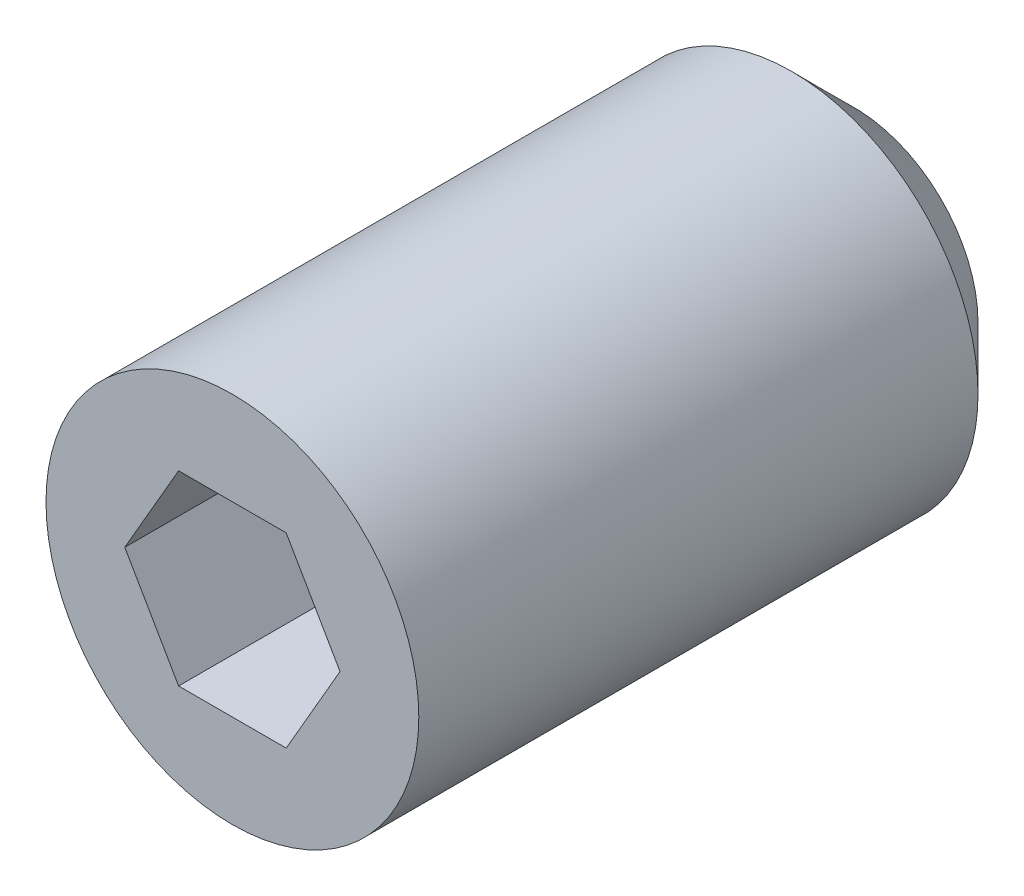
from build123d import *

# Parameters (mm, degrees)
SKETCH1_R           = 1.5
BOSS_EXTRUDE1_DEPTH = 5
CUT_EXTRUDE1_DEPTH  = 1.2


with BuildPart() as part:
    # Sketch1 → Boss-Extrude1 (new body)
    with BuildSketch(Plane.XY):
        Circle(SKETCH1_R)
    extrude(amount=-BOSS_EXTRUDE1_DEPTH)

    # Sketch2 → Cut-Extrude1 (cut)
    with BuildSketch(Plane.XY):
        Polygon((0.866025404, 0), (0.433012702, 0.75), (-0.433012702, 0.75), (-0.866025404, 0), (-0.433012702, -0.75), (0.433012702, -0.75), align=None)
    extrude(amount=-CUT_EXTRUDE1_DEPTH, mode=Mode.SUBTRACT)

    # Sketch3 → Chamfer 2 (revolve, cut)
    with BuildSketch(Plane(origin=(0, 0, 0), x_dir=(0, 0, -1), z_dir=(1, 0, 0)), mode=Mode.PRIVATE) as chamfer_2_sk:
        Polygon((5, 1.5), (5, 1), (4.5, 1.5), align=None)
    revolve(chamfer_2_sk.sketch.rotate(Axis((0, 0, 0), (0, 0, -1)), 90), axis=Axis((0, 0, 0), (0, 0, -1)), mode=Mode.SUBTRACT)


solid = part.part
